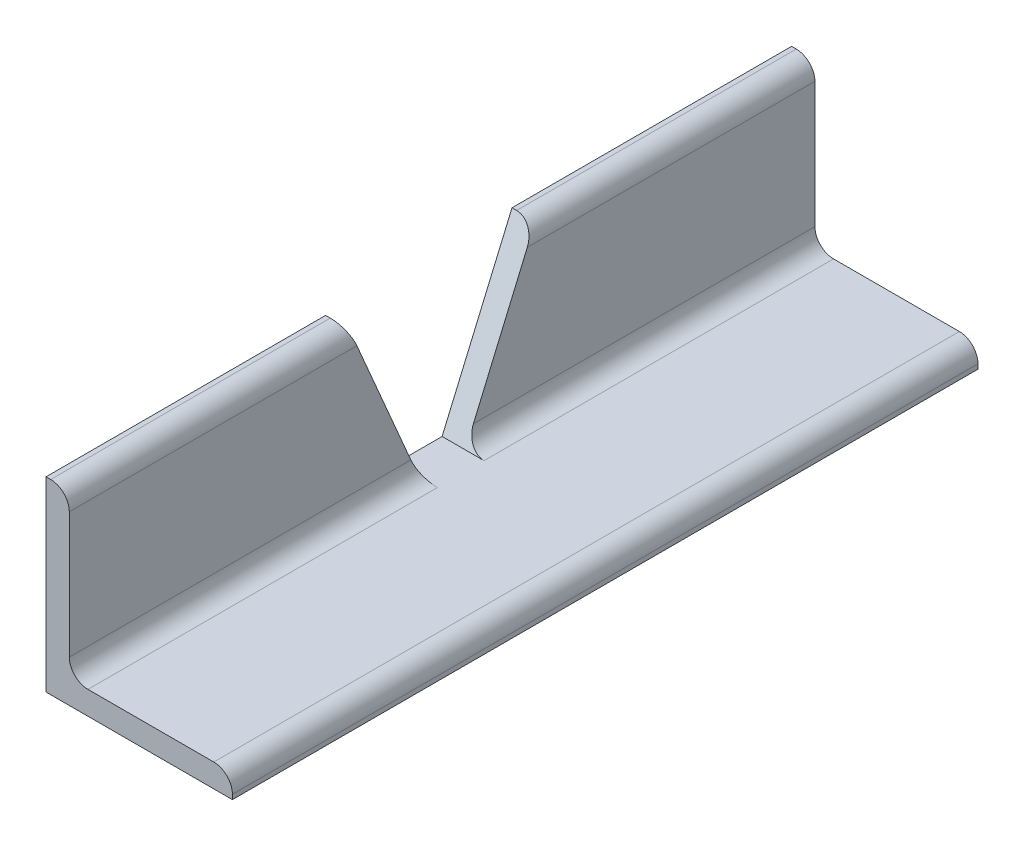
from build123d import *

# Parameters (mm, degrees)
BOSS_EXTRUDE1_DEPTH = 50.8
CUT_EXTRUDE1_DEPTH  = 59.198711326


with BuildPart() as part:
    # Sketch1 → Boss-Extrude1 (new, symmetric)
    with BuildSketch(Plane.XY):
        with BuildLine():
            Line((-12.7, 12.7), (-12.7, -12.7))
            Line((-12.7, -12.7), (12.7, -12.7))
            Line((12.7, -12.7), (12.7, -12.065))
            ThreePointArc((12.7, -12.065), (11.956051224, -10.268948776), (10.16, -9.525))
            Line((10.16, -9.525), (-6.985, -9.525))
            ThreePointArc((-6.985, -9.525), (-8.781051224, -8.781051224), (-9.525, -6.985))
            Line((-9.525, -6.985), (-9.525, 10.16))
            ThreePointArc((-9.525, 10.16), (-10.268948776, 11.956051224), (-12.065, 12.7))
            Line((-12.065, 12.7), (-12.7, 12.7))
        make_face()
    extrude(amount=BOSS_EXTRUDE1_DEPTH, both=True)

    # Sketch3 → Cut-Extrude1 (cut, through all)
    with BuildSketch(Plane.ZY.offset(12.7)):
        Polygon((-12.7, 12.7), (-3.175, -9.525), (3.175, -9.525), (12.7, 12.7), align=None)
    extrude(amount=-CUT_EXTRUDE1_DEPTH, mode=Mode.SUBTRACT)


solid = part.part
